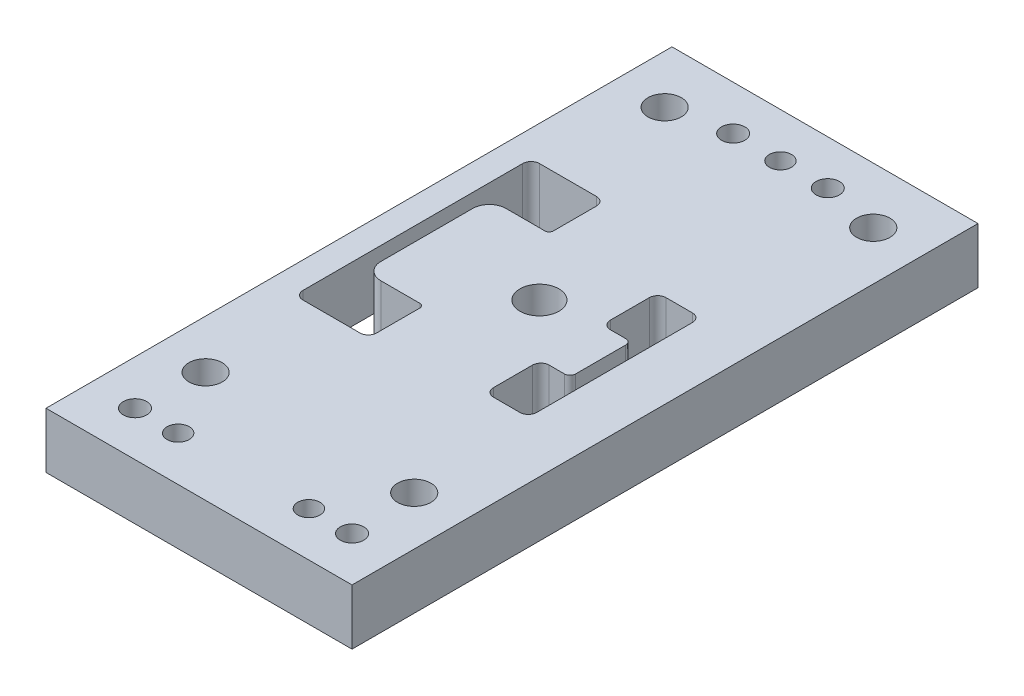
from build123d import *

# Parameters (mm, degrees)
SKETCH1_W                                           = 110
SKETCH1_H                                           = 225
BOSS_EXTRUDE1_DEPTH                                 = 20
CUT_EXTRUDE1_REACH                                  = 128.812
CUT_EXTRUDE2_REACH                                  = 128.812
SKETCH4_R                                           = 10.5
CUT_EXTRUDE3_DEPTH                                  = 14.2
CUT_EXTRUDE4_REACH                                  = 128.812
SKETCH5_R                                           = 6
CUT_EXTRUDE5_REACH                                  = 128.812
SKETCH6_R                                           = 7
CBORE_FOR_M8_HEX_SOCKET_HEAD_CAP_SCREW1_D           = 8.4
CBORE_FOR_M8_HEX_SOCKET_HEAD_CAP_SCREW1_CBORE_D     = 15
CBORE_FOR_M8_HEX_SOCKET_HEAD_CAP_SCREW1_CBORE_DEPTH = 8.6
F_8_0MM_DOWEL_HOLE1_D                               = 8


with BuildPart() as part:
    # Sketch1 → Boss-Extrude1 (new body)
    with BuildSketch(Plane(origin=(0, 0, 0), x_dir=(1, 0, 0), z_dir=(0, 1, 0))):
        Rectangle(SKETCH1_W, SKETCH1_H)
    extrude(amount=BOSS_EXTRUDE1_DEPTH)

    # Sketch2 → Cut-Extrude1 (cut, up to next)
    with BuildSketch(Plane(origin=(0, 20, 0), x_dir=(1, 0, 0), z_dir=(0, 1, 0)), mode=Mode.PRIVATE) as cut_extrude1_sk1:
        with BuildLine():
            Line((-42.5, -32.64), (-22, -32.64))
            ThreePointArc((-22, -32.64), (-19.878679656, -31.761320344), (-19, -29.64))
            Line((-19, -29.64), (-19, -14.14))
            ThreePointArc((-19, -14.14), (-19.439339828, -13.079339828), (-20.5, -12.64))
            Line((-20.5, -12.64), (-34.5, -12.64))
            ThreePointArc((-34.5, -12.64), (-38.742640687, -10.882640687), (-40.5, -6.64))
            Line((-40.5, -6.64), (-40.5, 26.36))
            ThreePointArc((-40.5, 26.36), (-38.742640687, 30.602640687), (-34.5, 32.36))
            Line((-34.5, 32.36), (-20.5, 32.36))
            ThreePointArc((-20.5, 32.36), (-19.439339828, 32.799339828), (-19, 33.86))
            Line((-19, 33.86), (-19, 49.36))
            ThreePointArc((-19, 49.36), (-19.878679656, 51.481320344), (-22, 52.36))
            Line((-22, 52.36), (-42.5, 52.36))
            ThreePointArc((-42.5, 52.36), (-44.621320344, 51.481320344), (-45.5, 49.36))
            Line((-45.5, 49.36), (-45.5, -29.64))
            ThreePointArc((-45.5, -29.64), (-44.621320344, -31.761320344), (-42.5, -32.64))
        make_face()
    cut_extrude1_tool1 = extrude(cut_extrude1_sk1.sketch, amount=-CUT_EXTRUDE1_REACH, mode=Mode.PRIVATE) & part.part
    add(cut_extrude1_tool1.solids().sort_by_distance((-43.991747, 20, -50.851747))[0], mode=Mode.SUBTRACT)

    # Sketch3 → Cut-Extrude2 (cut, up to next)
    with BuildSketch(Plane(origin=(0, 20, 0), x_dir=(1, 0, 0), z_dir=(0, 1, 0)), mode=Mode.PRIVATE) as cut_extrude2_sk1:
        with BuildLine():
            Line((22, -8.64), (27.5, -8.64))
            ThreePointArc((27.5, -8.64), (28.914213562, -8.054213562), (29.5, -6.64))
            Line((29.5, -6.64), (29.5, 11.36))
            ThreePointArc((29.5, 11.36), (28.914213562, 12.774213562), (27.5, 13.36))
            Line((27.5, 13.36), (22, 13.36))
            ThreePointArc((22, 13.36), (19.878679656, 14.238679656), (19, 16.36))
            Line((19, 16.36), (19, 30.36))
            ThreePointArc((19, 30.36), (19.878679656, 32.481320344), (22, 33.36))
            Line((22, 33.36), (31.5, 33.36))
            ThreePointArc((31.5, 33.36), (33.621320344, 32.481320344), (34.5, 30.36))
            Line((34.5, 30.36), (34.5, -25.64))
            ThreePointArc((34.5, -25.64), (33.621320344, -27.761320344), (31.5, -28.64))
            Line((31.5, -28.64), (22, -28.64))
            ThreePointArc((22, -28.64), (19.878679656, -27.761320344), (19, -25.64))
            Line((19, -25.64), (19, -11.64))
            ThreePointArc((19, -11.64), (19.878679656, -9.518679656), (22, -8.64))
        make_face()
    cut_extrude2_tool1 = extrude(cut_extrude2_sk1.sketch, amount=-CUT_EXTRUDE2_REACH, mode=Mode.PRIVATE) & part.part
    add(cut_extrude2_tool1.solids().sort_by_distance((24.75, 20, 9.279081))[0], mode=Mode.SUBTRACT)

    # Sketch4 → Cut-Extrude3 (cut)
    with BuildSketch(Plane.XZ):
        with Locations(Location((37.5, 52.64, 0), (0, 0, 270))):
            Circle(SKETCH4_R)
        with Locations(Location((12.5, 52.64, 0), (0, 0, 270))):
            Circle(SKETCH4_R)
        with Locations(Location((-12.5, 52.64, 0), (0, 0, 270))):
            Circle(SKETCH4_R)
        with Locations(Location((-37.5, 52.64, 0), (0, 0, 270))):
            Circle(SKETCH4_R)
        with Locations(Location((0, 10.14, 0), (0, 0, 270))):
            Circle(SKETCH4_R)
        with Locations(Location((0, -29.86, 0), (0, 0, 270))):
            Circle(SKETCH4_R)
        with Locations(Location((37.5, -72.36, 0), (0, 0, 270))):
            Circle(SKETCH4_R)
        with Locations(Location((12.5, -72.36, 0), (0, 0, 270))):
            Circle(SKETCH4_R)
        with Locations(Location((-12.5, -72.36, 0), (0, 0, 270))):
            Circle(SKETCH4_R)
        with Locations(Location((-37.5, -72.36, 0), (0, 0, 270))):
            Circle(SKETCH4_R)
    extrude(amount=-CUT_EXTRUDE3_DEPTH, mode=Mode.SUBTRACT)

    # Sketch5 → Cut-Extrude4 (cut, up to next)
    with BuildSketch(Plane(origin=(0, 20, 0), x_dir=(1, 0, 0), z_dir=(0, 1, 0)), mode=Mode.PRIVATE) as cut_extrude4_sk1:
        with Locations(Location((-37.5, 92.36, 0), (0, 0, 270))):
            Circle(SKETCH5_R)
    cut_extrude4_tool1 = extrude(cut_extrude4_sk1.sketch, amount=-CUT_EXTRUDE4_REACH, mode=Mode.PRIVATE) & part.part
    # Sketch5 → Cut-Extrude4 (cut, up to next)
    with BuildSketch(Plane(origin=(0, 20, 0), x_dir=(1, 0, 0), z_dir=(0, 1, 0)), mode=Mode.PRIVATE) as cut_extrude4_sk2:
        with Locations(Location((37.5, 92.36, 0), (0, 0, 270))):
            Circle(SKETCH5_R)
    cut_extrude4_tool2 = extrude(cut_extrude4_sk2.sketch, amount=-CUT_EXTRUDE4_REACH, mode=Mode.PRIVATE) & part.part
    # Sketch5 → Cut-Extrude4 (cut, up to next)
    with BuildSketch(Plane(origin=(0, 20, 0), x_dir=(1, 0, 0), z_dir=(0, 1, 0)), mode=Mode.PRIVATE) as cut_extrude4_sk3:
        with Locations(Location((-37.5, -72.64, 0), (0, 0, 270))):
            Circle(SKETCH5_R)
    cut_extrude4_tool3 = extrude(cut_extrude4_sk3.sketch, amount=-CUT_EXTRUDE4_REACH, mode=Mode.PRIVATE) & part.part
    # Sketch5 → Cut-Extrude4 (cut, up to next)
    with BuildSketch(Plane(origin=(0, 20, 0), x_dir=(1, 0, 0), z_dir=(0, 1, 0)), mode=Mode.PRIVATE) as cut_extrude4_sk4:
        with Locations(Location((37.5, -72.64, 0), (0, 0, 270))):
            Circle(SKETCH5_R)
    cut_extrude4_tool4 = extrude(cut_extrude4_sk4.sketch, amount=-CUT_EXTRUDE4_REACH, mode=Mode.PRIVATE) & part.part
    add(cut_extrude4_tool1.solids().sort_by_distance((-37.5, 20, -92.36))[0], mode=Mode.SUBTRACT)
    add(cut_extrude4_tool2.solids().sort_by_distance((37.5, 20, -92.36))[0], mode=Mode.SUBTRACT)
    add(cut_extrude4_tool3.solids().sort_by_distance((-37.5, 20, 72.64))[0], mode=Mode.SUBTRACT)
    add(cut_extrude4_tool4.solids().sort_by_distance((37.5, 20, 72.64))[0], mode=Mode.SUBTRACT)

    # Sketch6 → Cut-Extrude5 (cut, up to next)
    with BuildSketch(Plane(origin=(0, 20, 0), x_dir=(1, 0, 0), z_dir=(0, 1, 0)), mode=Mode.PRIVATE) as cut_extrude5_sk1:
        with Locations(Location((0, 9.86, 0), (0, 0, 270))):
            Circle(SKETCH6_R)
    cut_extrude5_tool1 = extrude(cut_extrude5_sk1.sketch, amount=-CUT_EXTRUDE5_REACH, mode=Mode.PRIVATE) & part.part
    add(cut_extrude5_tool1.solids().sort_by_distance((0, 20, -9.86))[0], mode=Mode.SUBTRACT)

    # CBORE for M8 Hex Socket Head Cap Screw1 (through all)
    with Locations(Plane(origin=(0, 0, 0), x_dir=(-1, 0, 0), z_dir=(0, -1, 0))):
        with Locations((-17, 96.5), (17, 96.5), (-39, -96.5), (39, -96.5)):
            CounterBoreHole(CBORE_FOR_M8_HEX_SOCKET_HEAD_CAP_SCREW1_D / 2, CBORE_FOR_M8_HEX_SOCKET_HEAD_CAP_SCREW1_CBORE_D / 2, CBORE_FOR_M8_HEX_SOCKET_HEAD_CAP_SCREW1_CBORE_DEPTH)

    # Ø8.0mm Dowel Hole1 (through all)
    with Locations(Plane(origin=(0, 0, 0), x_dir=(-1, 0, 0), z_dir=(0, -1, 0))):
        with Locations((0, 96.5), (-23.5, -96.5), (23.5, -96.5)):
            Hole(F_8_0MM_DOWEL_HOLE1_D / 2)


solid = part.part
